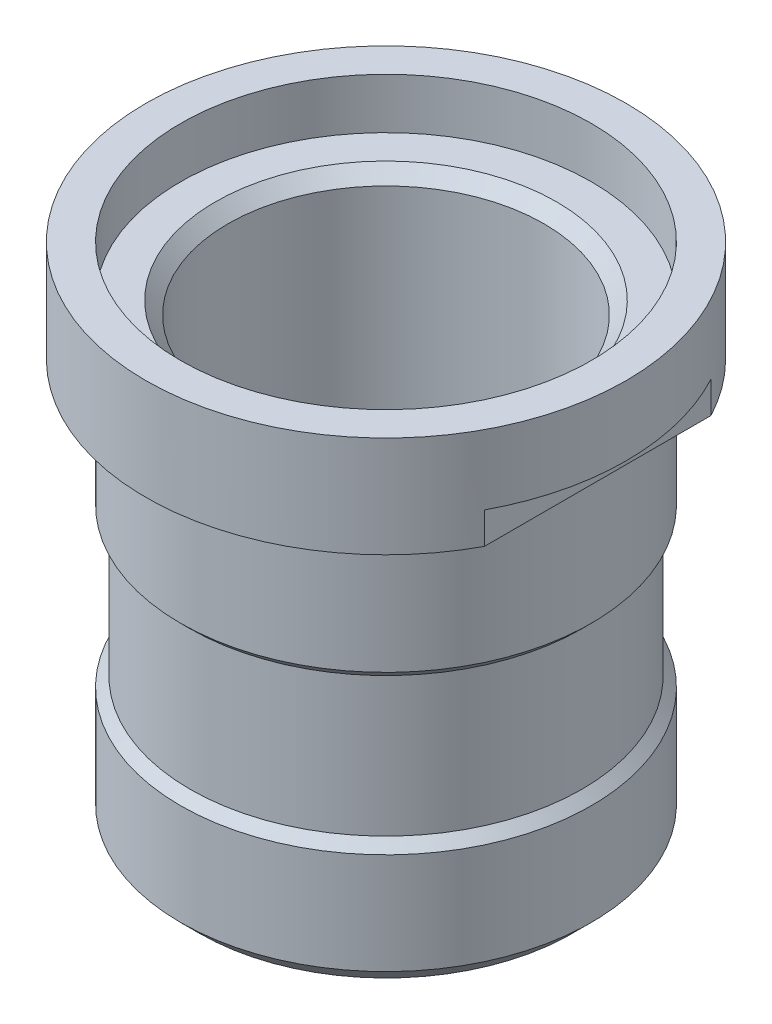
from build123d import *

# Parameters (mm, degrees)
CUT_EXTRUDE1_START = -11
SKETCH2_W          = 20.025201173
SKETCH2_H          = 73.268677232
CUT_EXTRUDE1_DEPTH = 86.374270425
CHAMFER1_SIZE      = 3


with BuildPart() as part:
    # Sketch1 → Revolve1 (revolve)
    with BuildSketch(Plane.XY, mode=Mode.PRIVATE) as revolve1_sk:
        Polygon((-32.5, 80), (-32.5, 72), (-27, 72), (-25, 70), (-25, 0), (-32.5, 0), (-32.5, 19), (-31, 20.5), (-31, 42.5), (-32.5, 44), (-32.5, 64), (-38, 64), (-38, 80), align=None)
    revolve(revolve1_sk.sketch.rotate(Axis((0, 0, 0), (0, 1, 0)), 270), axis=Axis((0, 0, 0), (0, 1, 0)))

    # Sketch2 → Cut-Extrude1 (cut, through all)
    with BuildSketch(Plane(origin=(0, 80, 0), x_dir=(1, 0, 0), z_dir=(0, 1, 0)).offset(CUT_EXTRUDE1_START)):
        with Locations((43.512600586, -0.824567107)):
            Rectangle(SKETCH2_W, SKETCH2_H)
    extrude(amount=-CUT_EXTRUDE1_DEPTH, mode=Mode.SUBTRACT)

    # Chamfer1
    chamfer1_edges = [part.edges().sort_by_distance(p)[0] for p in [
        (0, 0, 32.5),
    ]]
    chamfer(chamfer1_edges, length=CHAMFER1_SIZE)


solid = part.part
